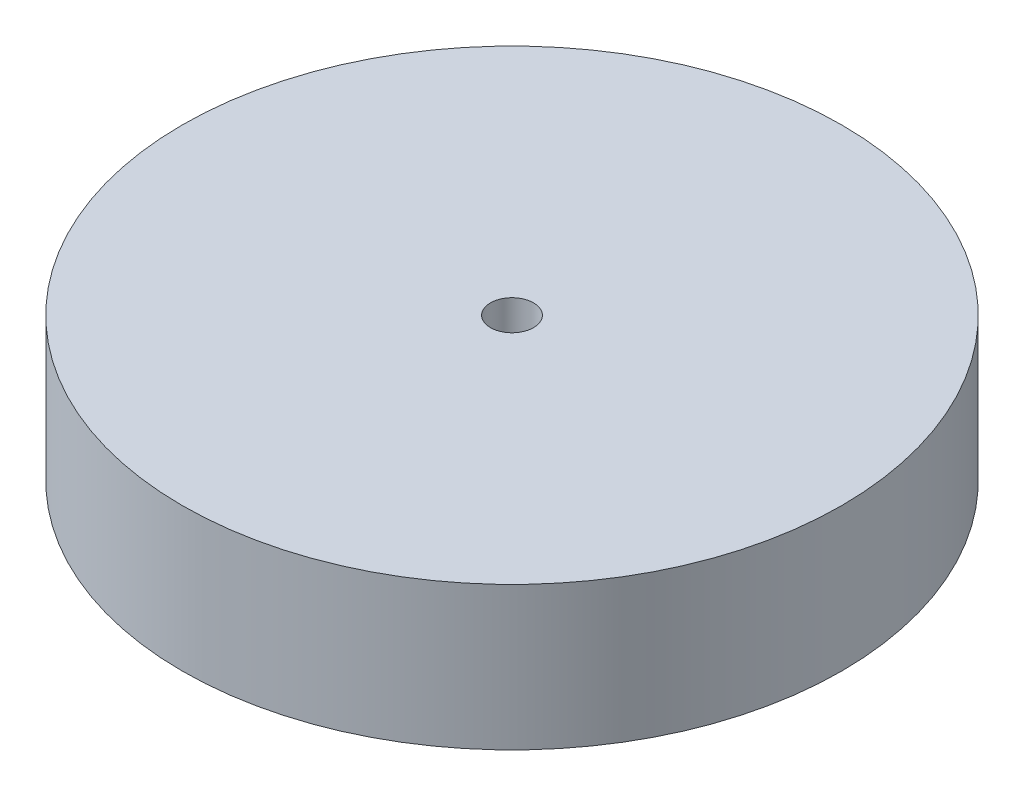
from build123d import *

# Parameters (mm, degrees)
SKETCH1_R           = 23
BOSS_EXTRUDE1_DEPTH = 10
SKETCH2_R           = 20
CUT_EXTRUDE1_DEPTH  = 7.3
SKETCH3_R           = 6
BOSS_EXTRUDE3_DEPTH = 14.5
SKETCH4_R           = 1.5
CUT_EXTRUDE2_DEPTH  = 17.2


with BuildPart() as part:
    # Sketch1 → Boss-Extrude1 (new body)
    with BuildSketch(Plane(origin=(0, 0, 0), x_dir=(1, 0, 0), z_dir=(0, 1, 0))):
        with Locations(Location((0, 0, 0), (0, 0, 270))):
            Circle(SKETCH1_R)
    extrude(amount=BOSS_EXTRUDE1_DEPTH)

    # Sketch2 → Cut-Extrude1 (cut)
    with BuildSketch(Plane.XZ):
        with Locations(Location((0, 0, 0), (0, 0, 270))):
            Circle(SKETCH2_R)
    extrude(amount=-CUT_EXTRUDE1_DEPTH, mode=Mode.SUBTRACT)

    # Sketch3 → Boss-Extrude3 (add)
    with BuildSketch(Plane.XZ.offset(-7.3)):
        with Locations(Location((0, 0, 0), (0, 0, 90))):
            Circle(SKETCH3_R)
    extrude(amount=BOSS_EXTRUDE3_DEPTH)

    # Sketch4 → Cut-Extrude2 (cut)
    with BuildSketch(Plane.XZ.offset(7.2)):
        with Locations(Location((0, 0, 0), (0, 0, 270))):
            Circle(SKETCH4_R)
    extrude(amount=-CUT_EXTRUDE2_DEPTH, mode=Mode.SUBTRACT)


solid = part.part
